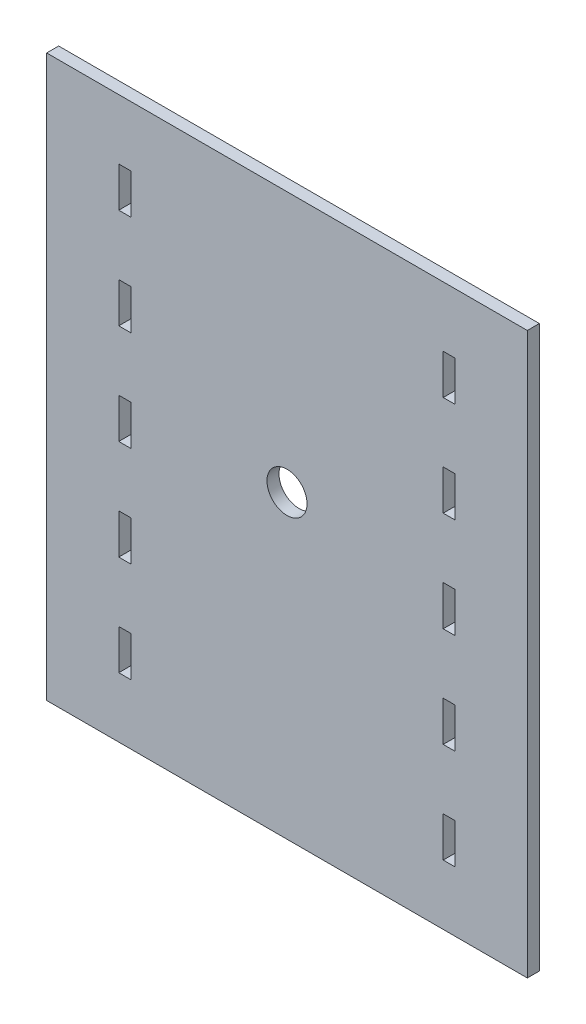
from build123d import *

# Parameters (mm, degrees)
ESQUISSE1_W             = 120
ESQUISSE1_H             = 140
BOSS_EXTRU_1_DEPTH      = 3
ESQUISSE3_R             = 5
ESQUISSE3_W             = 3
ESQUISSE3_H             = 10
ENL_V_MAT_EXTRU_1_DEPTH = 138.692369665


with BuildPart() as part:
    # Esquisse1 → Boss.-Extru.1 (new body)
    with BuildSketch(Plane.XY):
        with Locations((20.007954742, 42.021943574)):
            Rectangle(ESQUISSE1_W, ESQUISSE1_H)
    extrude(amount=BOSS_EXTRU_1_DEPTH)

    # Esquisse3 → Enlèv. mat.-Extru.1 (cut, through all)
    with BuildSketch(Plane.XY.offset(3)):
        with Locations((20.007954742, 47.021943574)):
            Circle(ESQUISSE3_R)
        with Locations((-20.492045258, 67.021943574)):
            Rectangle(ESQUISSE3_W, ESQUISSE3_H)
        with Locations((-20.492045258, 92.021943574)):
            Rectangle(ESQUISSE3_W, ESQUISSE3_H)
        with Locations((-20.492045258, -7.978056426)):
            Rectangle(ESQUISSE3_W, ESQUISSE3_H)
        with Locations((-20.492045258, 42.021943574)):
            Rectangle(ESQUISSE3_W, ESQUISSE3_H)
        with Locations((-20.492045258, 17.021943574)):
            Rectangle(ESQUISSE3_W, ESQUISSE3_H)
        with Locations((60.507954742, -7.978056426)):
            Rectangle(ESQUISSE3_W, ESQUISSE3_H)
        with Locations((60.507954742, 17.021943574)):
            Rectangle(ESQUISSE3_W, ESQUISSE3_H)
        with Locations((60.507954742, 42.021943574)):
            Rectangle(ESQUISSE3_W, ESQUISSE3_H)
        with Locations((60.507954742, 67.021943574)):
            Rectangle(ESQUISSE3_W, ESQUISSE3_H)
        with Locations((60.507954742, 92.021943574)):
            Rectangle(ESQUISSE3_W, ESQUISSE3_H)
    extrude(amount=-ENL_V_MAT_EXTRU_1_DEPTH, mode=Mode.SUBTRACT)


solid = part.part
